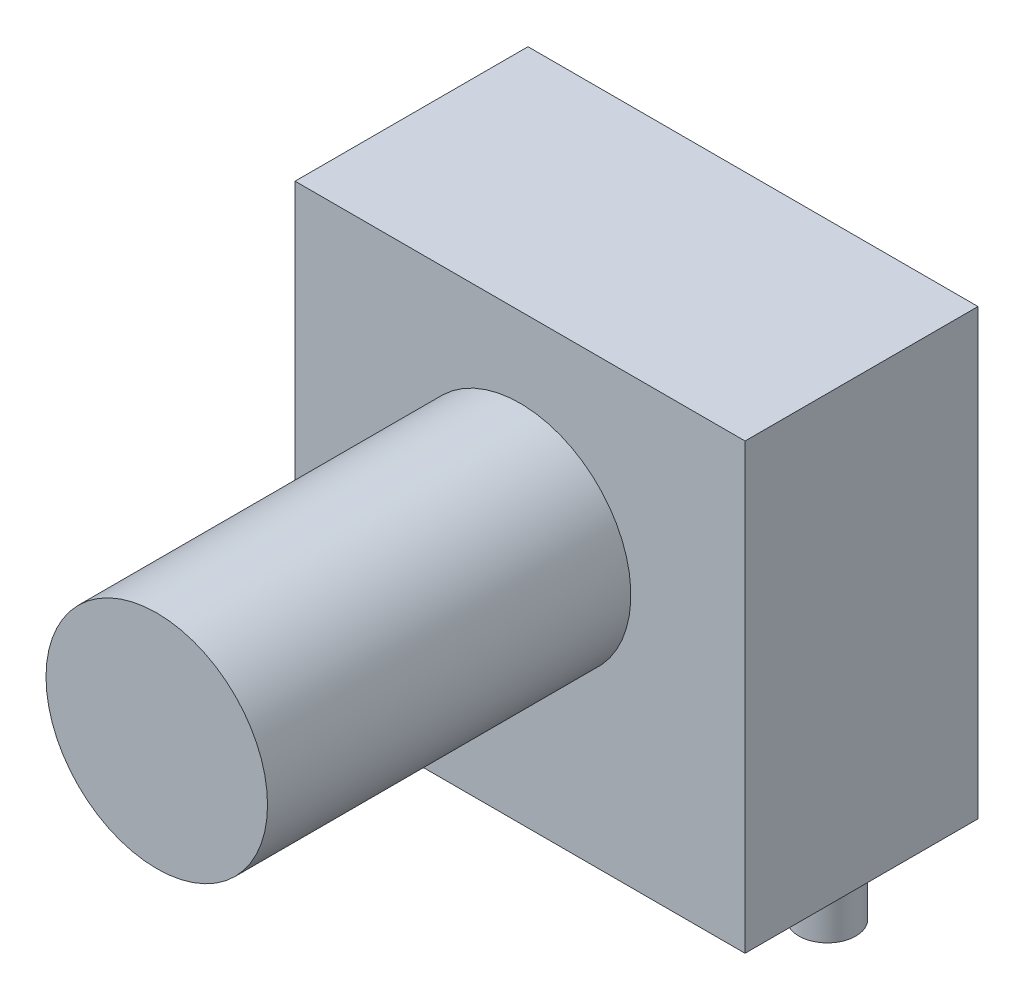
from build123d import *

# Parameters (mm, degrees)
SKETCH1_W           = 7.11
SKETCH1_H           = 3.68
BOSS_EXTRUDE1_DEPTH = 7.01
SKETCH2_R           = 1.75
BOSS_EXTRUDE2_DEPTH = 5.74
SKETCH3_R           = 0.45
BOSS_EXTRUDE3_DEPTH = 1.5


with BuildPart() as part:
    # Sketch1 → Boss-Extrude1 (new body)
    with BuildSketch(Plane(origin=(0, 0, 0), x_dir=(1, 0, 0), z_dir=(0, 1, 0))):
        Rectangle(SKETCH1_W, SKETCH1_H)
    extrude(amount=BOSS_EXTRUDE1_DEPTH)

    # Sketch2 → Boss-Extrude2 (add)
    with BuildSketch(Plane.XY.offset(1.84)):
        with Locations(Location((0, 4, 0), (0, 0, 180))):
            Circle(SKETCH2_R)
    extrude(amount=BOSS_EXTRUDE2_DEPTH)

    # Sketch3 → Boss-Extrude3 (add)
    with BuildSketch(Plane(origin=(0, 0, 0), x_dir=(1, 0, 0), z_dir=(0, 1, 0))):
        with Locations(Location((-2.245, 0.77, 0), (0, 0, 270))):
            Circle(SKETCH3_R)
        with Locations(Location((2.245, 0.77, 0), (0, 0, 270))):
            Circle(SKETCH3_R)
    extrude(amount=-BOSS_EXTRUDE3_DEPTH)


solid = part.part
